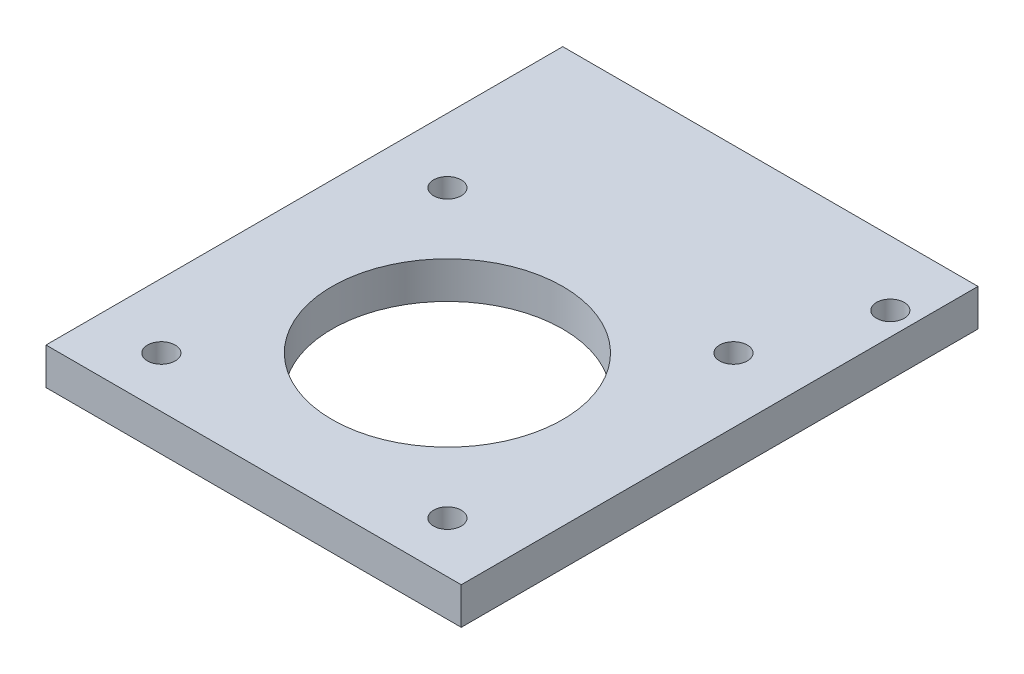
from build123d import *

# Parameters (mm, degrees)
ESBO_O1_W                = 45
ESBO_O1_H                = 56
RESSALTO_EXTRUS_O1_DEPTH = 4
ESBO_O4_R                = 1.5
ESBO_O4_R_2              = 12.5
CORTE_EXTRUS_O1_DEPTH    = 37.142080737


with BuildPart() as part:
    # Esboço1 → Ressalto-extrusão1 (new body)
    with BuildSketch(Plane(origin=(0, 0, 0), x_dir=(1, 0, 0), z_dir=(0, 1, 0))):
        Rectangle(ESBO_O1_W, ESBO_O1_H)
    extrude(amount=RESSALTO_EXTRUS_O1_DEPTH)

    # Esboço4 → Corte-extrusão1 (cut, through all)
    with BuildSketch(Plane(origin=(0, 4, 0), x_dir=(1, 0, 0), z_dir=(0, 1, 0))):
        with Locations(Location((-15.5, 8.5, 0), (0, 0, 270))):
            Circle(ESBO_O4_R)
        with Locations(Location((-15.5, -22.5, 0), (0, 0, 270))):
            Circle(ESBO_O4_R)
        with Locations(Location((15.5, -22.5, 0), (0, 0, 270))):
            Circle(ESBO_O4_R)
        with Locations(Location((15.5, 8.5, 0), (0, 0, 270))):
            Circle(ESBO_O4_R)
        with Locations(Location((20, 21, 0), (0, 0, 270))):
            Circle(ESBO_O4_R)
        with Locations(Location((0, -7, 0), (0, 0, 270))):
            Circle(ESBO_O4_R_2)
    extrude(amount=-CORTE_EXTRUS_O1_DEPTH, mode=Mode.SUBTRACT)


solid = part.part
